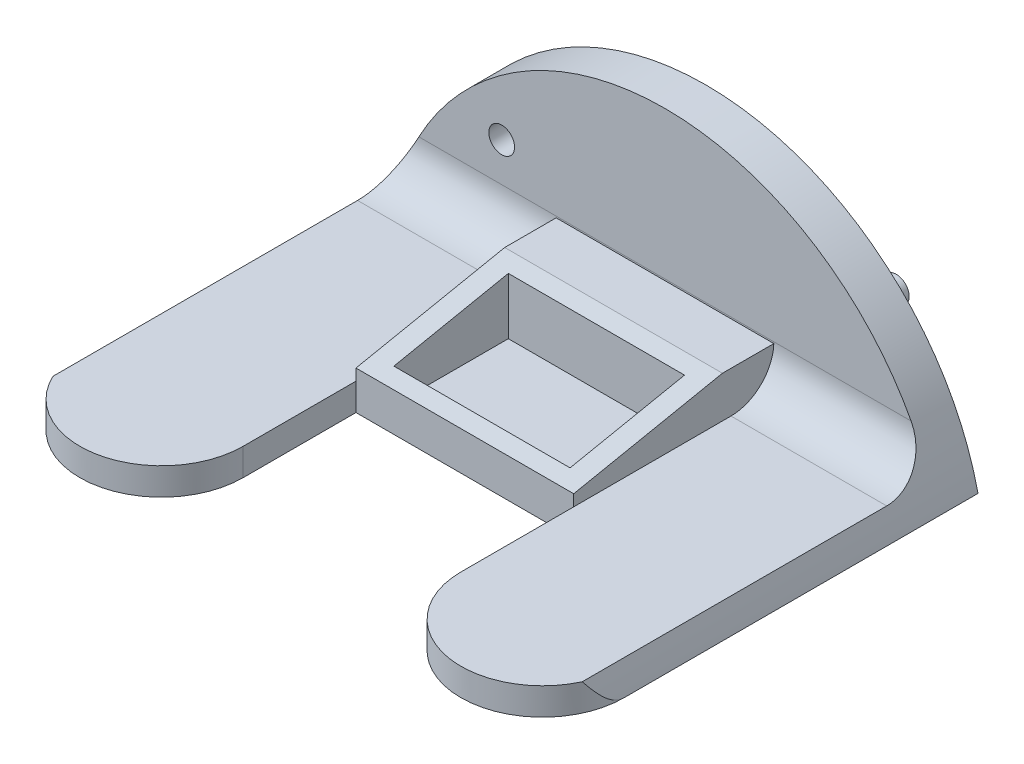
from build123d import *

# Parameters (mm, degrees)
BOSS_EXTRUDE1_DEPTH = 63.5
SKETCH3_R           = 1.5
CUT_EXTRUDE1_DEPTH  = 86.194189943
SKETCH3_3_R         = 1.5
BOSS_EXTRUDE2_DEPTH = 3.175
CUT_EXTRUDE2_DEPTH  = 86.194189943
CUT_EXTRUDE3_DEPTH  = 3.175
SKETCH6_W           = 25.4
SKETCH6_H           = 17.35
BOSS_EXTRUDE3_DEPTH = 1
BOSS_EXTRUDE4_START = -1
SKETCH6_3_W         = 25.4
SKETCH6_3_H         = 23.35
SKETCH6_3_W_2       = 20.55
SKETCH6_3_H_2       = 13.35
BOSS_EXTRUDE4_DEPTH = 7
CUT_EXTRUDE4_DEPTH  = 73.122136159
SKETCH6_4_W         = 25.4
SKETCH6_4_H         = 6
BOSS_EXTRUDE5_DEPTH = 3.175
FILLET2_R           = 5


with BuildPart() as part:
    # Sketch2 → Boss-Extrude1 (new body)
    with BuildSketch(Plane(origin=(0, 0, 0), x_dir=(0, 0, -1), z_dir=(1, 0, 0))):
        Polygon((-50.8, 0), (0, 0), (0, 25.4), (-4.7625, 25.4), (-4.7625, 3.175), (-50.8, 3.175), align=None)
    extrude(amount=BOSS_EXTRUDE1_DEPTH)

    # Sketch3 → Cut-Extrude1 (cut, through all)
    with BuildSketch(Plane(origin=(0, 0, 0), x_dir=(-1, 0, 0), z_dir=(0, 0, -1))):
        with Locations(Location((-12.7, 12.7, 0), (0, 0, 90))):
            Circle(SKETCH3_R)
    extrude(amount=-CUT_EXTRUDE1_DEPTH, mode=Mode.SUBTRACT)

    # Sketch3<3> → Boss-Extrude2 (add)
    with BuildSketch(Plane(origin=(0, 0, 0), x_dir=(-1, 0, 0), z_dir=(0, 0, -1))):
        with Locations(Location((-50.8, 12.7, 0), (0, 0, 180))):
            Circle(SKETCH3_3_R)
    extrude(amount=BOSS_EXTRUDE2_DEPTH)

    # Sketch4 → Cut-Extrude2 (cut, through all)
    with BuildSketch(Plane(origin=(0, 0, 0), x_dir=(-1, 0, 0), z_dir=(0, 0, -1))):
        with BuildLine():
            Line((-63.5, 25.4), (-63.5, 0))
            ThreePointArc((-63.5, 0), (-52.079919454, 18.268649317), (-31.75, 25.4))
            Line((-31.75, 25.4), (-63.5, 25.4))
        make_face()
        with BuildLine():
            ThreePointArc((-31.75, 25.4), (-11.420080546, 18.268649317), (0, 0))
            Line((0, 0), (0, 25.4))
            Line((0, 25.4), (-31.75, 25.4))
        make_face()
    extrude(amount=-CUT_EXTRUDE2_DEPTH, mode=Mode.SUBTRACT)

    # Sketch5 → Cut-Extrude3 (cut)
    with BuildSketch(Plane(origin=(0, 3.175, 0), x_dir=(1, 0, 0), z_dir=(0, 1, 0))):
        with BuildLine():
            Line((44.45, -4.7625), (19.05, -4.7625))
            Line((19.05, -4.7625), (19.05, -41.275))
            ThreePointArc((19.05, -41.275), (16.260192091, -48.010192091), (9.525, -50.8))
            Line((9.525, -50.8), (53.975, -50.8))
            ThreePointArc((53.975, -50.8), (47.239807909, -48.010192091), (44.45, -41.275))
            Line((44.45, -41.275), (44.45, -4.7625))
        make_face()
        with BuildLine():
            ThreePointArc((9.525, -50.8), (4.400279527, -49.303876949), (0.885472424, -45.285509726))
            Line((0.885472424, -45.285509726), (0.885472424, -50.8))
            Line((0.885472424, -50.8), (9.525, -50.8))
        make_face()
        with BuildLine():
            ThreePointArc((0.885472424, -45.285509726), (0.224002065, -43.328548738), (0, -41.275))
            Line((0, -41.275), (0, -50.8))
            Line((0, -50.8), (0.885472424, -50.8))
            Line((0.885472424, -50.8), (0.885472424, -45.285509726))
        make_face()
        with BuildLine():
            ThreePointArc((62.614527576, -45.285509726), (59.099720473, -49.303876949), (53.975, -50.8))
            Line((53.975, -50.8), (62.614527576, -50.8))
            Line((62.614527576, -50.8), (62.614527576, -45.285509726))
        make_face()
        with BuildLine():
            ThreePointArc((63.5, -41.275), (63.275997935, -43.328548738), (62.614527576, -45.285509726))
            Line((62.614527576, -45.285509726), (62.614527576, -50.8))
            Line((62.614527576, -50.8), (63.5, -50.8))
            Line((63.5, -50.8), (63.5, -41.275))
        make_face()
    extrude(amount=-CUT_EXTRUDE3_DEPTH, mode=Mode.SUBTRACT)

    # Sketch6 → Boss-Extrude3 (add)
    with BuildSketch(Plane.XZ):
        with Locations((31.75, 19.4375)):
            Rectangle(SKETCH6_W, SKETCH6_H)
    extrude(amount=-BOSS_EXTRUDE3_DEPTH)

    # Sketch6<3> → Boss-Extrude4 (add)
    with BuildSketch(Plane.XZ.offset(BOSS_EXTRUDE4_START)):
        with Locations((31.75, 16.4375)):
            Rectangle(SKETCH6_3_W, SKETCH6_3_H)
        with Locations((31.75, 19.4375)):
            Rectangle(SKETCH6_3_W_2, SKETCH6_3_H_2, mode=Mode.SUBTRACT)
    extrude(amount=-BOSS_EXTRUDE4_DEPTH)

    # Sketch7 → Cut-Extrude4 (cut, through all)
    with BuildSketch(Plane.ZY.offset(-19.05)):
        Polygon((10.7625, 8), (28.1125, 8), (28.1125, 4.5), align=None)
    extrude(amount=-CUT_EXTRUDE4_DEPTH, mode=Mode.SUBTRACT)

    # Sketch6<4> → Boss-Extrude5 (add)
    with BuildSketch(Plane.XZ):
        with Locations((31.75, 7.7625)):
            Rectangle(SKETCH6_4_W, SKETCH6_4_H)
    extrude(amount=-BOSS_EXTRUDE5_DEPTH)

    # Fillet2
    fillet2_edges = [part.edges().sort_by_distance(p)[0] for p in [
        (9.967736212, 3.175, 4.7625),
    ]]
    fillet(fillet2_edges, radius=FILLET2_R)


solid = part.part
